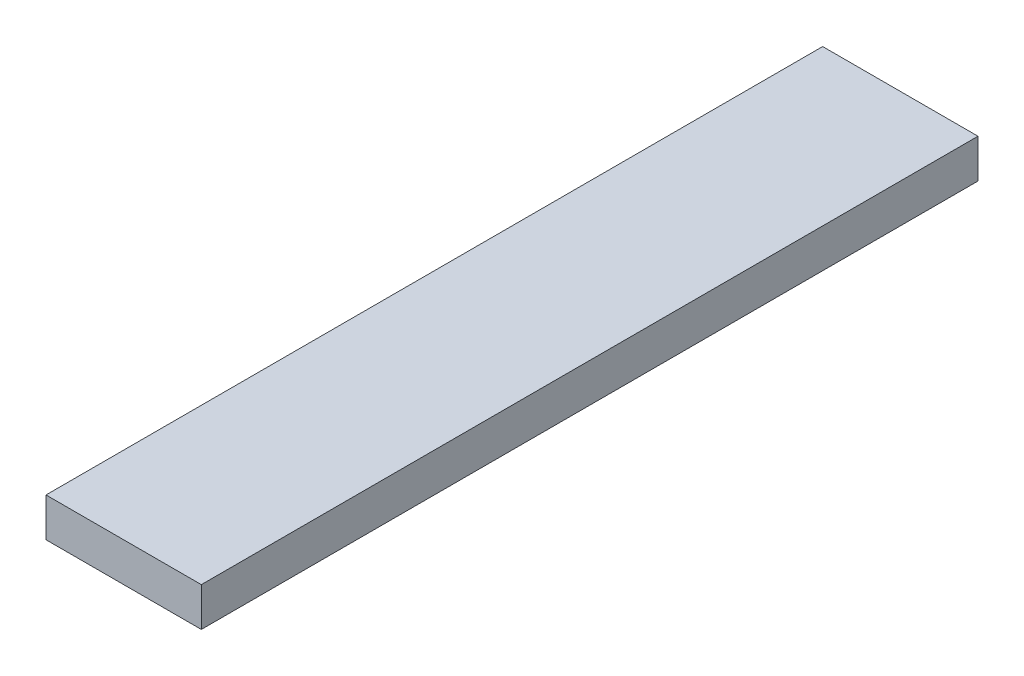
from build123d import *

# Parameters (mm, degrees)
SKETCH_1_W      = 4
SKETCH_1_H      = 20
EXTRUDE_1_DEPTH = 1


with BuildPart() as part:
    # 草图1 → 凸台-拉伸1 (new body)
    with BuildSketch(Plane(origin=(0, 0, 0), x_dir=(1, 0, 0), z_dir=(0, 1, 0))):
        with Locations((2, 10)):
            Rectangle(SKETCH_1_W, SKETCH_1_H)
    extrude(amount=EXTRUDE_1_DEPTH)


solid = part.part
